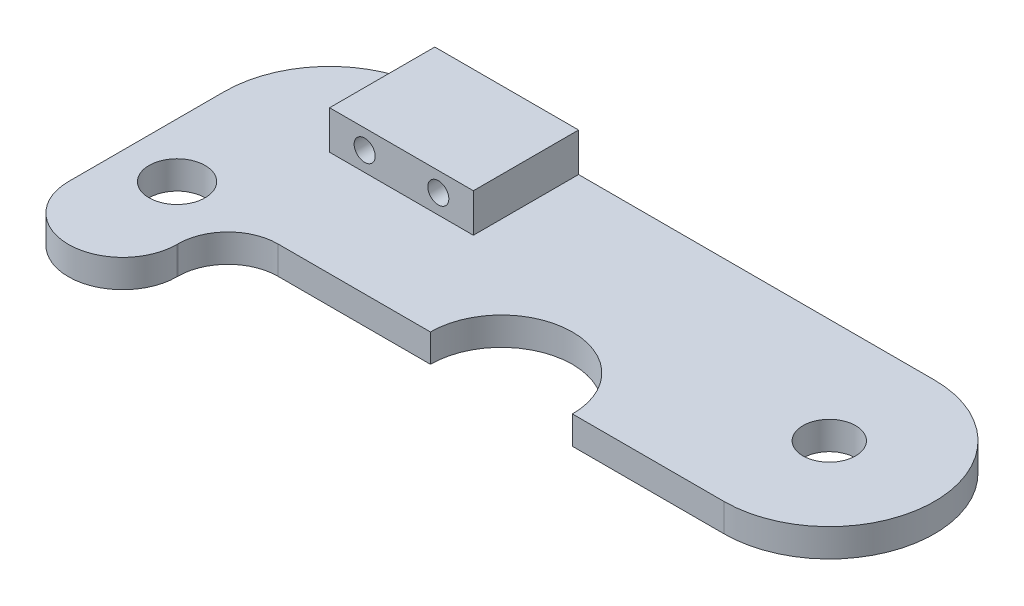
from build123d import *

# Parameters (mm, degrees)
SKETCH1_R           = 15
SKETCH1_R_2         = 16
BOSS_EXTRUDE2_DEPTH = 16
SCALE1_SCALE        = 0.1
SKETCH2_W           = 8.2
SKETCH2_H           = 6
BOSS_EXTRUDE3_DEPTH = 2.2
CUT_EXTRUDE1_REACH  = 32.213
SKETCH3_R           = 0.6


with BuildPart() as part:
    # Sketch1 → Boss-Extrude2 (new body)
    with BuildSketch(Plane(origin=(0, 0, 0), x_dir=(1, 0, 0), z_dir=(0, 1, 0))):
        with BuildLine():
            Line((71.949541284, -40.775229358), (158.449541284, -40.775229358))
            ThreePointArc((158.449541284, -40.775229358), (218.449541284, 19.224770642), (158.449541284, 79.224770642))
            Line((158.449541284, 79.224770642), (-126.550458716, 79.224770642))
            ThreePointArc((-126.550458716, 79.224770642), (-168.976865587, 61.651177513), (-186.550458716, 19.224770642))
            Line((-186.550458716, 19.224770642), (-186.550458716, -40.775229358))
            Line((-186.550458716, -40.775229358), (-186.550458716, -69.775229358))
            ThreePointArc((-186.550458716, -69.775229358), (-155.550458716, -100.775229358), (-124.550458716, -69.775229358))
            Line((-124.550458716, -69.775229358), (-124.550458716, -69.275229358))
            ThreePointArc((-124.550458716, -69.275229358), (-116.203001979, -49.122686094), (-96.050458716, -40.775229358))
            Line((-96.050458716, -40.775229358), (-9.050458716, -40.775229358))
            ThreePointArc((-9.050458716, -40.775229358), (31.449541284, -0.275229358), (71.949541284, -40.775229358))
        make_face()
        with Locations(Location((158.449541284, 19.224770642, 0), (0, 0, 270))):
            Circle(SKETCH1_R, mode=Mode.SUBTRACT)
        with Locations(Location((-155.550458716, -38.775229358, 0), (0, 0, 270))):
            Circle(SKETCH1_R_2, mode=Mode.SUBTRACT)
    extrude(amount=BOSS_EXTRUDE2_DEPTH)


with BuildPart() as part_1:
    # Scale1: scaled about (-0.239262204, 8, -15.310747356)
    add(part.part.scale(SCALE1_SCALE).moved(Location((-0.215335984, 7.2, -13.77967262))))

    # Sketch2 → Boss-Extrude3 (add)
    with BuildSketch(Plane(origin=(0, 8.8, 0), x_dir=(1, 0, 0), z_dir=(0, 1, 0))):
        with Locations((-8.770381855, 18.702149685)):
            Rectangle(SKETCH2_W, SKETCH2_H)
    extrude(amount=BOSS_EXTRUDE3_DEPTH)

    # Sketch3 → Cut-Extrude1 (cut, up to next)
    with BuildSketch(Plane(origin=(0, 0, -21.702149685), x_dir=(-1, 0, 0), z_dir=(0, 0, -1)), mode=Mode.PRIVATE) as cut_extrude1_sk1:
        with Locations((6.670381855, 9.9)):
            Circle(SKETCH3_R)
    cut_extrude1_tool1 = extrude(cut_extrude1_sk1.sketch, amount=-CUT_EXTRUDE1_REACH, mode=Mode.PRIVATE) & part_1.part
    # Sketch3 → Cut-Extrude1 (cut, up to next)
    with BuildSketch(Plane(origin=(0, 0, -21.702149685), x_dir=(-1, 0, 0), z_dir=(0, 0, -1)), mode=Mode.PRIVATE) as cut_extrude1_sk2:
        with Locations((10.870381855, 9.9)):
            Circle(SKETCH3_R)
    cut_extrude1_tool2 = extrude(cut_extrude1_sk2.sketch, amount=-CUT_EXTRUDE1_REACH, mode=Mode.PRIVATE) & part_1.part
    add(cut_extrude1_tool1.solids().sort_by_distance((-6.670382, 9.9, -21.70215))[0], mode=Mode.SUBTRACT)
    add(cut_extrude1_tool2.solids().sort_by_distance((-10.870382, 9.9, -21.70215))[0], mode=Mode.SUBTRACT)


solid = part_1.part
